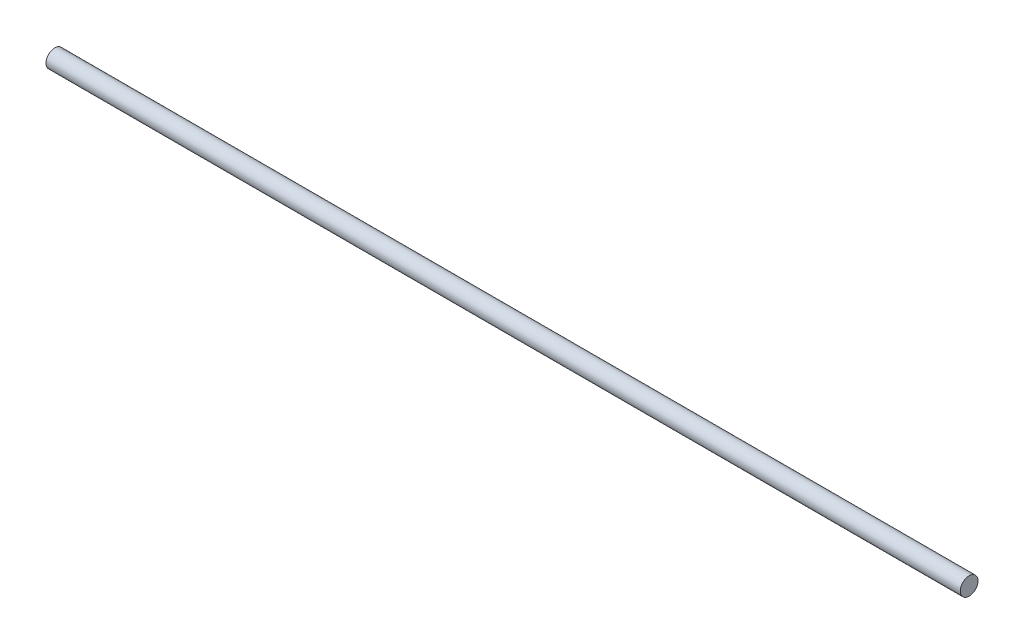
from build123d import *

# Parameters (mm, degrees)
SKETCH1_R           = 6
BOSS_EXTRUDE1_DEPTH = 310


with BuildPart() as part:
    # Sketch1 → Boss-Extrude1 (new, symmetric)
    with BuildSketch(Plane(origin=(0, 0, 0), x_dir=(0, 0, -1), z_dir=(1, 0, 0))):
        Circle(SKETCH1_R)
    extrude(amount=BOSS_EXTRUDE1_DEPTH, both=True)


solid = part.part
